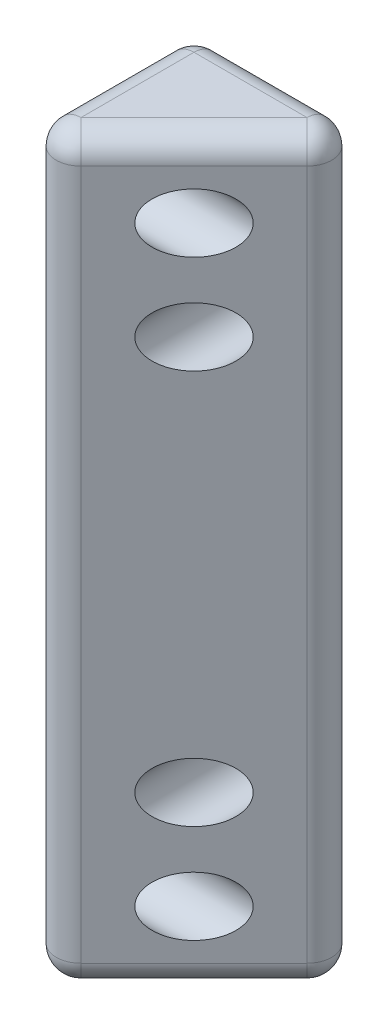
from build123d import *

# Parameters (mm, degrees)
BOSS_EXTRUDE1_DEPTH = 23.8125
SKETCH2_R           = 1.905
CUT_EXTRUDE1_DEPTH  = 30.826417087
SKETCH3_R           = 1.905
CUT_EXTRUDE2_DEPTH  = 30.826417087
FILLET1_R           = 1.5875


with BuildPart() as part:
    # Sketch1 → Boss-Extrude1 (new, symmetric)
    with BuildSketch(Plane(origin=(0, 0, 0), x_dir=(1, 0, 0), z_dir=(0, 1, 0))):
        Polygon((0, 0), (-12.7, 0), (-12.7, -12.7), align=None)
    extrude(amount=BOSS_EXTRUDE1_DEPTH, both=True)

    # Sketch2 → Cut-Extrude1 (cut, through all)
    with BuildSketch(Plane.ZY.offset(12.7)):
        with Locations((6.35, 19.05)):
            Circle(SKETCH2_R)
        with Locations((6.35, -19.05)):
            Circle(SKETCH2_R)
    extrude(amount=-CUT_EXTRUDE1_DEPTH, mode=Mode.SUBTRACT)

    # Sketch3 → Cut-Extrude2 (cut, through all)
    with BuildSketch(Plane(origin=(0, 0, 0), x_dir=(-1, 0, 0), z_dir=(0, 0, -1))):
        with Locations((6.35, -12.7)):
            Circle(SKETCH3_R)
        with Locations((6.35, 12.7)):
            Circle(SKETCH3_R)
    extrude(amount=-CUT_EXTRUDE2_DEPTH, mode=Mode.SUBTRACT)

    # Fillet1
    fillet1_edges = [part.edges().sort_by_distance(p)[0] for p in [
        (-12.7, 23.8125, 6.35),
        (-12.7, -23.8125, 6.35),
        (-6.35, -23.8125, 0),
        (-6.35, -23.8125, 6.35),
        (-6.35, 23.8125, 6.35),
        (-12.7, 0, 12.7),
        (-12.7, 0, 0),
        (0, 0, 0),
        (-6.35, 23.8125, 0),
    ]]
    fillet(fillet1_edges, radius=FILLET1_R)


solid = part.part
